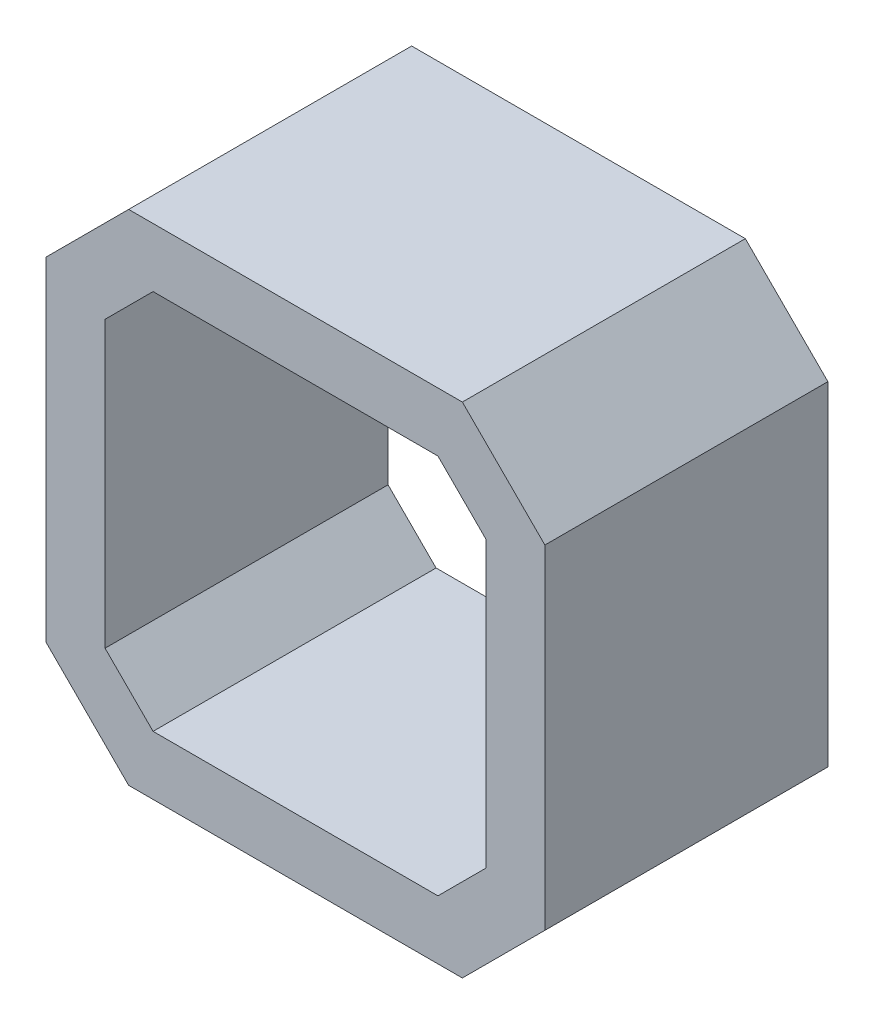
from build123d import *

# Parameters (mm, degrees)
BOSS_EXTRUDE1_DEPTH = 24
SCALE1_SCALE        = 3.5


with BuildPart() as part:
    # Sketch1 → Boss-Extrude1 (new body)
    with BuildSketch(Plane.XY):
        Polygon((-21.15, 14.15), (-14.15, 21.15), (14.15, 21.15), (21.15, 14.15), (21.15, -14.15), (14.15, -21.15), (-14.15, -21.15), (-21.15, -14.15), align=None)
        Polygon((-12.078932188, 16.15), (12.078932188, 16.15), (16.15, 12.078932188), (16.15, -12.078932188), (12.078932188, -16.15), (-12.078932188, -16.15), (-16.15, -12.078932188), (-16.15, 12.078932188), align=None, mode=Mode.SUBTRACT)
    extrude(amount=BOSS_EXTRUDE1_DEPTH)


with BuildPart() as part_1:
    # Scale1: scaled about (0, 0, 0)
    add(part.part.scale(SCALE1_SCALE))


solid = part_1.part
